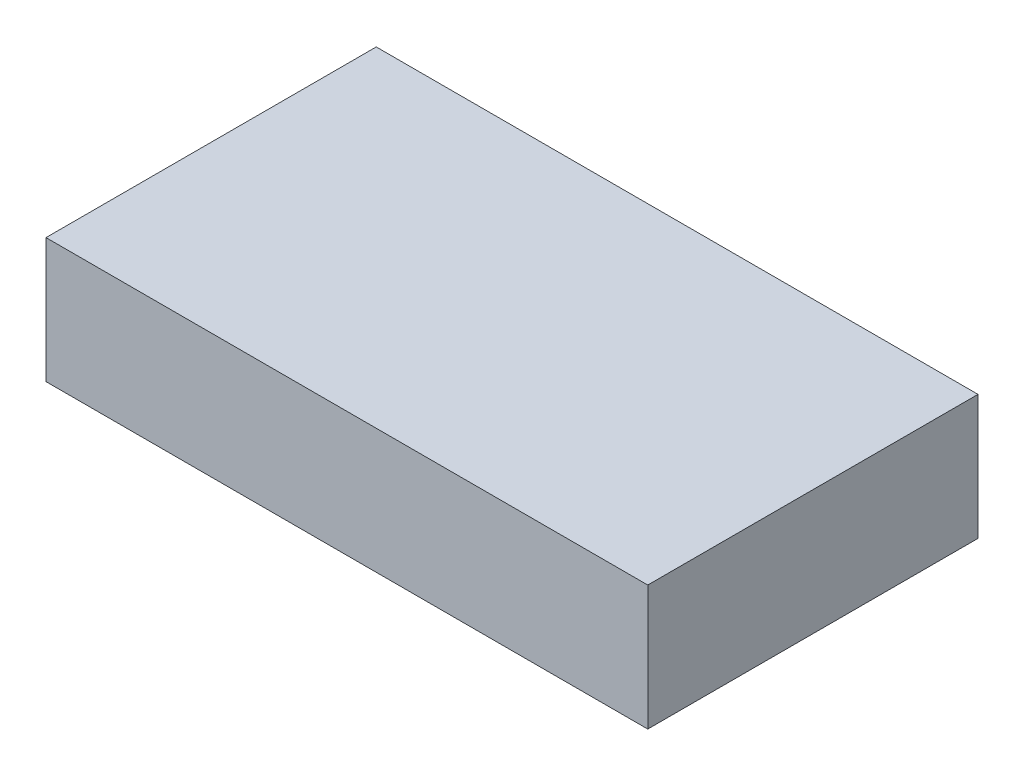
from build123d import *

# Parameters (mm, degrees)
SKETCH_1_W      = 82
SKETCH_1_H      = 45
EXTRUDE_1_DEPTH = 17


with BuildPart() as part:
    # 草圖1 → 填料-伸長1 (new body)
    with BuildSketch(Plane(origin=(0, 0, 0), x_dir=(1, 0, 0), z_dir=(0, 1, 0))):
        with Locations((41, 22.5)):
            Rectangle(SKETCH_1_W, SKETCH_1_H)
    extrude(amount=EXTRUDE_1_DEPTH)


solid = part.part
